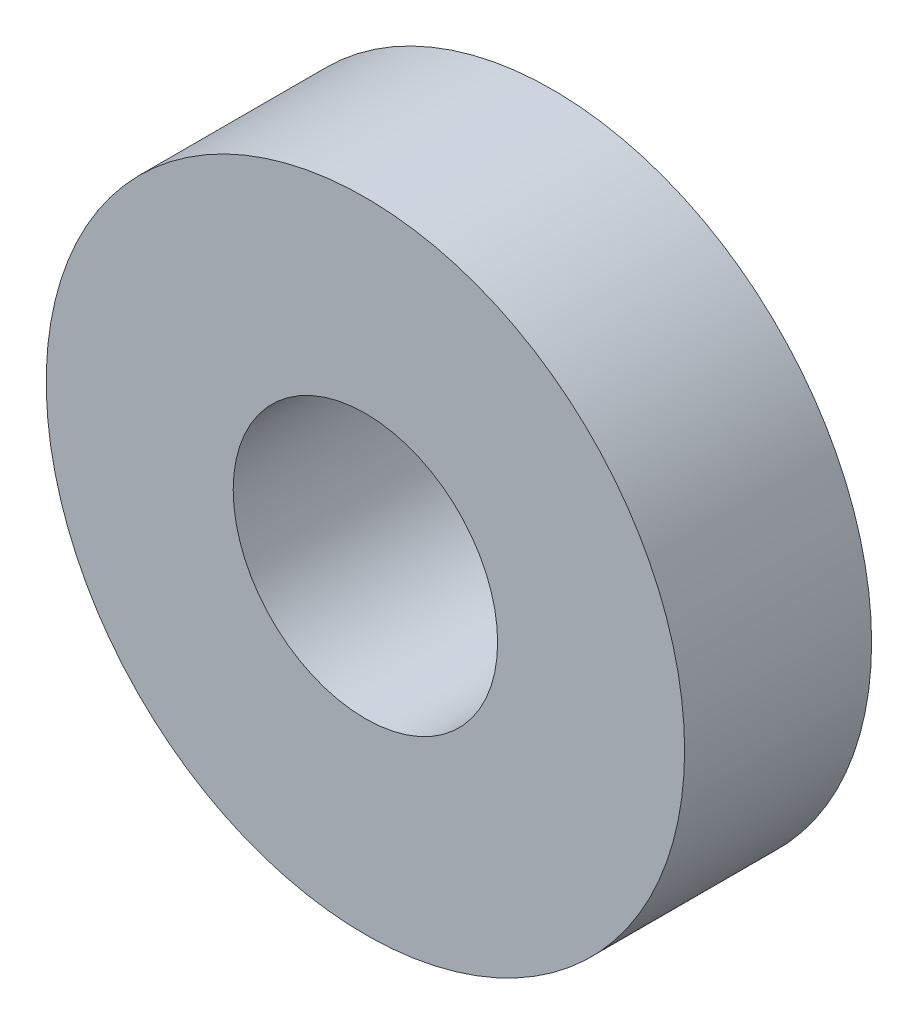
from build123d import *

# Parameters (mm, degrees)
SKETCH1_R           = 10.84
BOSS_EXTRUDE1_DEPTH = 6.35
SKETCH4_R           = 4.490128061
CUT_EXTRUDE1_DEPTH  = 17.593182335


with BuildPart() as part:
    # Sketch1 → Boss-Extrude1 (new body)
    with BuildSketch(Plane.XY):
        Circle(SKETCH1_R)
    extrude(amount=BOSS_EXTRUDE1_DEPTH)

    # Sketch4 → Cut-Extrude1 (cut, through all)
    with BuildSketch(Plane.XY.offset(6.35)):
        Circle(SKETCH4_R)
    extrude(amount=-CUT_EXTRUDE1_DEPTH, mode=Mode.SUBTRACT)


solid = part.part
